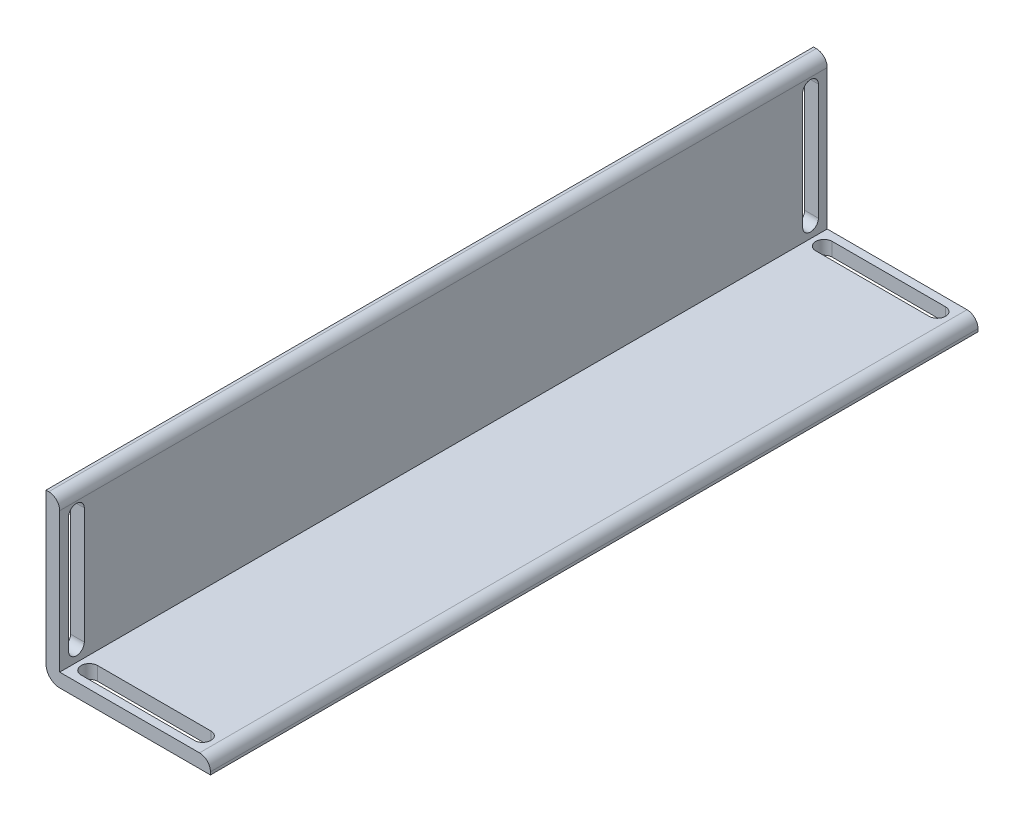
from build123d import *

# Parameters (mm, degrees)
BOSS_EXTRUDE1_DEPTH = 177.8
FILLET1_R           = 3.175
CUT_EXTRUDE2_DEPTH  = 177.8
CUT_EXTRUDE6_DEPTH  = 177.8


with BuildPart() as part:
    # Sketch1 → Boss-Extrude1 (new body)
    with BuildSketch(Plane.XY):
        with BuildLine():
            Line((0, 0), (0, 38.1))
            Line((0, 38.1), (0.635, 38.1))
            ThreePointArc((0.635, 38.1), (2.431051224, 37.356051224), (3.175, 35.56))
            Line((3.175, 35.56), (3.175, 3.175))
            Line((3.175, 3.175), (35.56, 3.175))
            ThreePointArc((35.56, 3.175), (37.356051224, 2.431051224), (38.1, 0.635))
            Line((38.1, 0.635), (38.1, 0))
            Line((38.1, 0), (0, 0))
        make_face()
    extrude(amount=BOSS_EXTRUDE1_DEPTH)

    # Fillet1
    fillet1_edges = [part.edges().sort_by_distance(p)[0] for p in [
        (0, 0, 88.9),
    ]]
    fillet(fillet1_edges, radius=FILLET1_R)

    # Sketch2 → Cut-Extrude2 (cut)
    with BuildSketch(Plane(origin=(3.175, 0, 0), x_dir=(0, 0, -1), z_dir=(1, 0, 0))):
        with BuildLine():
            Line((-172.101028795, 33.266000832), (-172.101028795, 6.35722327))
            ThreePointArc((-172.101028795, 6.35722327), (-173.92929525, 4.528956814), (-175.757561706, 6.35722327))
            Line((-175.757561706, 6.35722327), (-175.757561706, 33.266000832))
            ThreePointArc((-175.757561706, 33.266000832), (-173.92929525, 35.094267287), (-172.101028795, 33.266000832))
        make_face()
        with BuildLine():
            Line((-5.698971205, 33.266000832), (-5.698971205, 6.35722327))
            ThreePointArc((-5.698971205, 6.35722327), (-3.87070475, 4.528956814), (-2.042438294, 6.35722327))
            Line((-2.042438294, 6.35722327), (-2.042438294, 33.266000832))
            ThreePointArc((-2.042438294, 33.266000832), (-3.87070475, 35.094267287), (-5.698971205, 33.266000832))
        make_face()
    extrude(amount=-CUT_EXTRUDE2_DEPTH, mode=Mode.SUBTRACT)

    # Sketch6 → Cut-Extrude6 (cut)
    with BuildSketch(Plane.XZ):
        with BuildLine():
            Line((32.490336277, 175.895), (6.232036019, 175.895))
            ThreePointArc((6.232036019, 175.895), (4.327036019, 173.99), (6.232036019, 172.085))
            Line((6.232036019, 172.085), (32.490336277, 172.085))
            ThreePointArc((32.490336277, 172.085), (34.395336277, 173.99), (32.490336277, 175.895))
        make_face()
        with BuildLine():
            ThreePointArc((6.232036019, 1.905), (4.327036019, 3.81), (6.232036019, 5.715))
            Line((6.232036019, 5.715), (32.490336277, 5.715))
            ThreePointArc((32.490336277, 5.715), (34.395336277, 3.81), (32.490336277, 1.905))
            Line((32.490336277, 1.905), (6.232036019, 1.905))
        make_face()
    extrude(amount=-CUT_EXTRUDE6_DEPTH, mode=Mode.SUBTRACT)


solid = part.part
